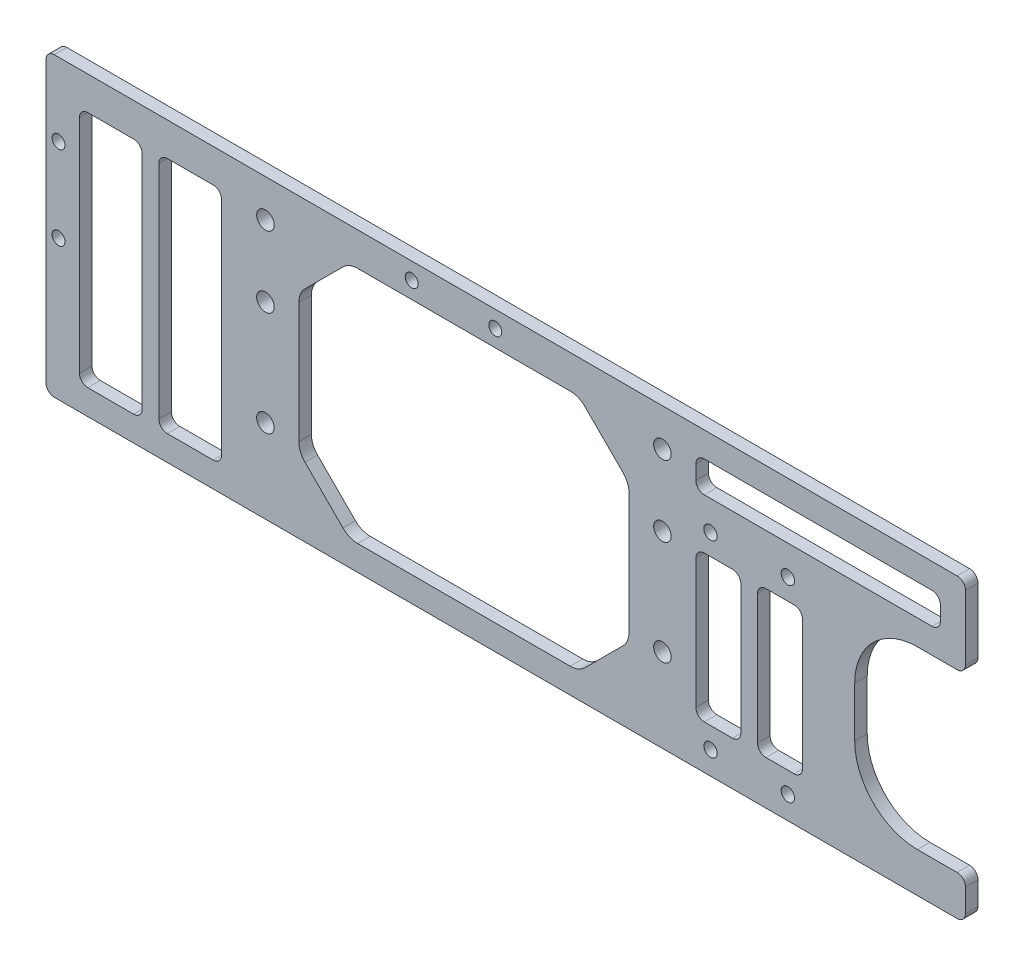
from build123d import *

# Parameters (mm, degrees)
SKETCH_1_W           = 200
SKETCH_1_H           = 54
SKETCH_1_R           = 2.1
EXTRUDE_1_DEPTH      = 3
SKETCH_3_W           = 200
SKETCH_3_H           = 14
EXTRUDE_2_DEPTH      = 3
SKETCH_2_R           = 1.6
CUT_EXTRUDE_1_DEPTH  = 10
EXTRUDE_3_DEPTH      = 3
SKETCH_5_W           = 26.5
SKETCH_5_H           = 42
CUT_EXTRUDE_2_DEPTH  = 10
FILLET_1_R           = 15
FILLET_2_R           = 2
SKETCH_14_W          = 79
SKETCH_14_H          = 57
CUT_EXTRUDE_7_DEPTH  = 10
CHAMFER_1_SIZE       = 12
FILLET_4_R           = 5
SKETCH_15_W          = 15
SKETCH_15_H          = 57
SKETCH_15_W_2        = 10.75
SKETCH_15_H_2        = 35
CUT_EXTRUDE_10_DEPTH = 10
FILLET_5_R           = 2
SKETCH_16_W          = 52.508149225
SKETCH_16_H          = 7.45
SKETCH_16_W_2        = 5.991850775
CUT_EXTRUDE_11_DEPTH = 10
FILLET_6_R           = 2
SKETCH_17_R          = 1.55
CUT_EXTRUDE_12_DEPTH = 10
SKETCH_18_R          = 1.55
CUT_EXTRUDE_13_DEPTH = 10


with BuildPart() as part:
    # 草图1 → 凸台-拉伸1 (new body)
    with BuildSketch(Plane.XY):
        Rectangle(SKETCH_1_W, SKETCH_1_H)
        with Locations((-47.5, 21)):
            Circle(SKETCH_1_R, mode=Mode.SUBTRACT)
        with Locations((-47.5, 4)):
            Circle(SKETCH_1_R, mode=Mode.SUBTRACT)
        with Locations((-47.5, -21)):
            Circle(SKETCH_1_R, mode=Mode.SUBTRACT)
        with Locations(Location((47.5, -21, 0), (0, 0, 180))):
            Circle(SKETCH_1_R, mode=Mode.SUBTRACT)
        with Locations(Location((47.5, 4, 0), (0, 0, 180))):
            Circle(SKETCH_1_R, mode=Mode.SUBTRACT)
        with Locations(Location((47.5, 21, 0), (0, 0, 180))):
            Circle(SKETCH_1_R, mode=Mode.SUBTRACT)
    extrude(amount=EXTRUDE_1_DEPTH)

    # 草图3 → 凸台-拉伸2 (add)
    with BuildSketch(Plane.XY.offset(3)):
        with Locations((0, -34)):
            Rectangle(SKETCH_3_W, SKETCH_3_H)
    extrude(amount=-EXTRUDE_2_DEPTH)

    # 草图2 → 切除-拉伸1 (cut)
    with BuildSketch(Plane.XY.offset(3)):
        with Locations((59, 9.5)):
            Circle(SKETCH_2_R)
        with Locations((77.5, 9.5)):
            Circle(SKETCH_2_R)
        with Locations((77.5, -35.5)):
            Circle(SKETCH_2_R)
        with Locations((59, -35.5)):
            Circle(SKETCH_2_R)
    extrude(amount=-CUT_EXTRUDE_1_DEPTH, mode=Mode.SUBTRACT)

    # 草图4 → 凸台-拉伸3 (add)
    with BuildSketch(Plane.XY.offset(3)):
        Polygon((-100, 30), (-100, 27), (100, 27), (100, -41), (120, -41), (120, 30), align=None)
    extrude(amount=-EXTRUDE_3_DEPTH)

    # 草图5 → 切除-拉伸2 (cut)
    with BuildSketch(Plane.XY.offset(3)):
        with Locations((106.75, -10.45)):
            Rectangle(SKETCH_5_W, SKETCH_5_H)
    extrude(amount=-CUT_EXTRUDE_2_DEPTH, mode=Mode.SUBTRACT)

    # 圆角1
    fillet_1_edges = [part.edges().sort_by_distance(p)[0] for p in [
        (93.5, -31.45, 1.5),
        (93.5, 10.55, 1.5),
    ]]
    fillet(fillet_1_edges, radius=FILLET_1_R)

    # 圆角2
    fillet_2_edges = [part.edges().sort_by_distance(p)[0] for p in [
        (-100, -41, 1.5),
        (120, -41, 1.5),
        (120, 30, 1.5),
        (-100, 30, 1.5),
        (120, 10.55, 1.5),
        (120, -31.45, 1.5),
    ]]
    fillet(fillet_2_edges, radius=FILLET_2_R)

    # 草图14 → 切除-拉伸7 (cut)
    with BuildSketch(Plane(origin=(0, 0, 0), x_dir=(-1, 0, 0), z_dir=(0, 0, -1))):
        with Locations((0, -6.5)):
            Rectangle(SKETCH_14_W, SKETCH_14_H)
    extrude(amount=-CUT_EXTRUDE_7_DEPTH, mode=Mode.SUBTRACT)

    # 倒角1
    chamfer_1_edges = [part.edges().sort_by_distance(p)[0] for p in [
        (-39.5, 22, 1.5),
        (-39.5, -35, 1.5),
        (39.5, -35, 1.5),
        (39.5, 22, 1.5),
    ]]
    chamfer(chamfer_1_edges, length=CHAMFER_1_SIZE)

    # 圆角4
    fillet_4_edges = [part.edges().sort_by_distance(p)[0] for p in [
        (27.5, 22, 1.5),
        (-27.5, 22, 1.5),
        (-39.5, -23, 1.5),
        (-39.5, 10, 1.5),
        (27.5, -35, 1.5),
        (-27.5, -35, 1.5),
        (39.5, 10, 1.5),
        (39.5, -23, 1.5),
    ]]
    fillet(fillet_4_edges, radius=FILLET_4_R)

    # 草图15 → 切除-拉伸10 (cut)
    with BuildSketch(Plane(origin=(0, 0, 0), x_dir=(-1, 0, 0), z_dir=(0, 0, -1))):
        with Locations((65.5, -6.5)):
            Rectangle(SKETCH_15_W, SKETCH_15_H)
        with Locations((84.5, -6.5)):
            Rectangle(SKETCH_15_W, SKETCH_15_H)
        with Locations((-60.875, -13)):
            Rectangle(SKETCH_15_W_2, SKETCH_15_H_2)
        with Locations((-75.625, -13)):
            Rectangle(SKETCH_15_W_2, SKETCH_15_H_2)
    extrude(amount=-CUT_EXTRUDE_10_DEPTH, mode=Mode.SUBTRACT)

    # 圆角5
    fillet_5_edges = [part.edges().sort_by_distance(p)[0] for p in [
        (70.25, 4.5, 1.5),
        (70.25, -30.5, 1.5),
        (81, -30.5, 1.5),
        (81, 4.5, 1.5),
        (66.25, 4.5, 1.5),
        (55.5, 4.5, 1.5),
        (55.5, -30.5, 1.5),
        (66.25, -30.5, 1.5),
        (-92, -35, 1.5),
        (-77, -35, 1.5),
        (-77, 22, 1.5),
        (-92, 22, 1.5),
        (-58, 22, 1.5),
        (-73, 22, 1.5),
        (-73, -35, 1.5),
        (-58, -35, 1.5),
    ]]
    fillet(fillet_5_edges, radius=FILLET_5_R)

    # 草图16 → 切除-拉伸11 (cut)
    with BuildSketch(Plane(origin=(0, 0, 0), x_dir=(-1, 0, 0), z_dir=(0, 0, -1))):
        with Locations((-87.745925387, 20.275)):
            Rectangle(SKETCH_16_W, SKETCH_16_H)
        with Locations((-58.495925388, 20.275)):
            Rectangle(SKETCH_16_W_2, SKETCH_16_H)
    extrude(amount=-CUT_EXTRUDE_11_DEPTH, mode=Mode.SUBTRACT)

    # 圆角6
    fillet_6_edges = [part.edges().sort_by_distance(p)[0] for p in [
        (55.5, 16.55, 1.5),
        (114, 16.55, 1.5),
        (114, 24, 1.5),
        (55.5, 24, 1.5),
    ]]
    fillet(fillet_6_edges, radius=FILLET_6_R)

    # 草图17 → 切除-拉伸12 (cut)
    with BuildSketch(Plane(origin=(0, 0, 0), x_dir=(-1, 0, 0), z_dir=(0, 0, -1))):
        with Locations((-7.5, 26)):
            Circle(SKETCH_17_R)
        with Locations((12.5, 26)):
            Circle(SKETCH_17_R)
    extrude(amount=-CUT_EXTRUDE_12_DEPTH, mode=Mode.SUBTRACT)

    # 草图18 → 切除-拉伸13 (cut)
    with BuildSketch(Plane(origin=(0, 0, 0), x_dir=(-1, 0, 0), z_dir=(0, 0, -1))):
        with Locations((97, 12.5)):
            Circle(SKETCH_18_R)
        with Locations((97, -7.5)):
            Circle(SKETCH_18_R)
    extrude(amount=-CUT_EXTRUDE_13_DEPTH, mode=Mode.SUBTRACT)


solid = part.part
